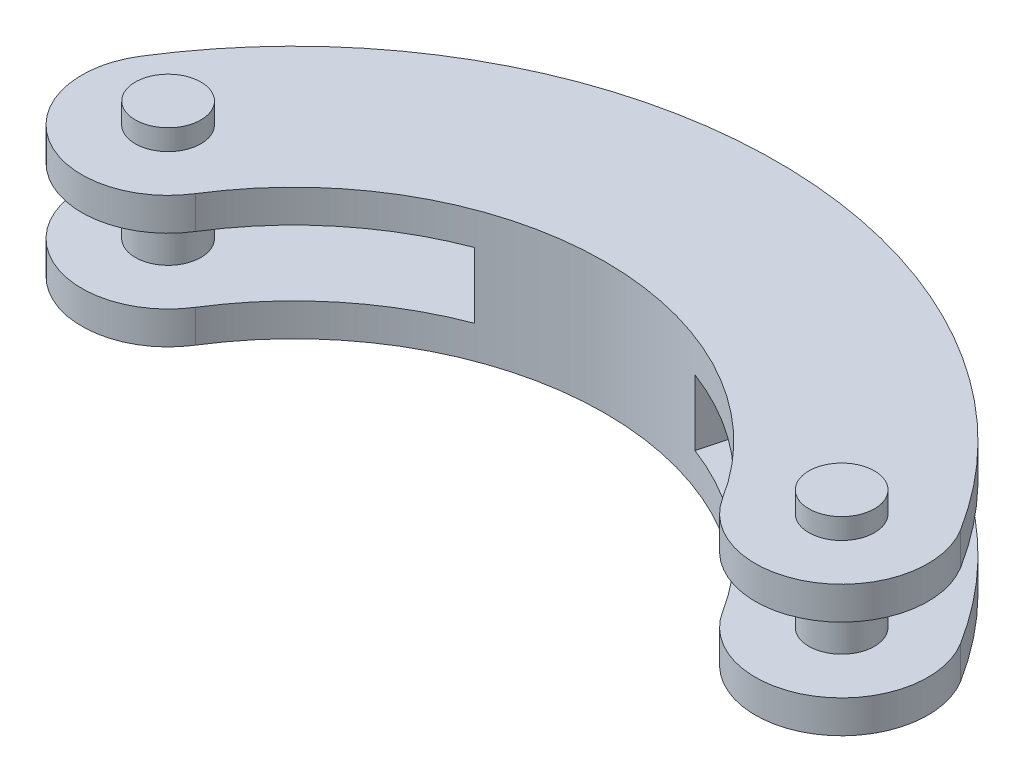
from build123d import *

# Parameters (mm, degrees)
BOSS_EXTRUDE1_DEPTH = 9.5
BOSS_EXTRUDE2_DEPTH = 19
BOSS_EXTRUDE3_DEPTH = 9.5
SKETCH4_R           = 9.5
CUT_EXTRUDE1_DEPTH  = 151.612195549
BOSS_EXTRUDE4_START = 6
SKETCH4_2_R         = 9.5
BOSS_EXTRUDE4_DEPTH = 50


with BuildPart() as part:
    # Sketch1 → Boss-Extrude1 (new body)
    with BuildSketch(Plane(origin=(0, 0, 0), x_dir=(1, 0, 0), z_dir=(0, 1, 0))):
        with BuildLine():
            ThreePointArc((118.682293684, -40.676118471), (0, 25), (-118.682293684, -40.676118471))
            ThreePointArc((-118.682293684, -40.676118471), (-110.778193938, -75.136606094), (-76.317706316, -67.232506348))
            ThreePointArc((-76.317706316, -67.232506348), (0, -25), (76.317706316, -67.232506348))
            ThreePointArc((76.317706316, -67.232506348), (110.778193938, -75.136606094), (118.682293684, -40.676118471))
        make_face()
    extrude(amount=BOSS_EXTRUDE1_DEPTH)

    # Sketch2 → Boss-Extrude2 (add)
    with BuildSketch(Plane(origin=(0, 9.5, 0), x_dir=(1, 0, 0), z_dir=(0, 1, 0))):
        with BuildLine():
            ThreePointArc((-31.926647669, -30.848128785), (0, -25), (31.926647669, -30.848128785))
            Line((31.926647669, -30.848128785), (44.909728312, 17.605387816))
            ThreePointArc((44.909728312, 17.605387816), (0, 25), (-44.909728312, 17.605387816))
            Line((-44.909728312, 17.605387816), (-31.926647669, -30.848128785))
        make_face()
    extrude(amount=BOSS_EXTRUDE2_DEPTH)

    # Sketch3 → Boss-Extrude3 (add)
    with BuildSketch(Plane(origin=(0, 28.5, 0), x_dir=(1, 0, 0), z_dir=(0, 1, 0))):
        with BuildLine():
            ThreePointArc((76.317706316, -67.232506348), (110.778193938, -75.136606094), (118.682293684, -40.676118471))
            ThreePointArc((118.682293684, -40.676118471), (0, 25), (-118.682293684, -40.676118471))
            ThreePointArc((-118.682293684, -40.676118471), (-110.778193938, -75.136606094), (-76.317706316, -67.232506348))
            ThreePointArc((-76.317706316, -67.232506348), (0, -25), (76.317706316, -67.232506348))
        make_face()
    extrude(amount=BOSS_EXTRUDE3_DEPTH)

    # Sketch4 → Cut-Extrude1 (cut, through all)
    with BuildSketch(Plane(origin=(0, 38, 0), x_dir=(1, 0, 0), z_dir=(0, 1, 0))):
        with Locations((-97.5, -53.95431241)):
            Circle(SKETCH4_R)
        with Locations((97.5, -53.95431241)):
            Circle(SKETCH4_R)
    extrude(amount=-CUT_EXTRUDE1_DEPTH, mode=Mode.SUBTRACT)

    # Sketch4<2> → Boss-Extrude4 (add)
    with BuildSketch(Plane(origin=(0, 38, 0), x_dir=(1, 0, 0), z_dir=(0, 1, 0)).offset(BOSS_EXTRUDE4_START)):
        with Locations((-97.5, -53.95431241)):
            Circle(SKETCH4_2_R)
        with Locations((97.5, -53.95431241)):
            Circle(SKETCH4_2_R)
    extrude(amount=-BOSS_EXTRUDE4_DEPTH)


solid = part.part
